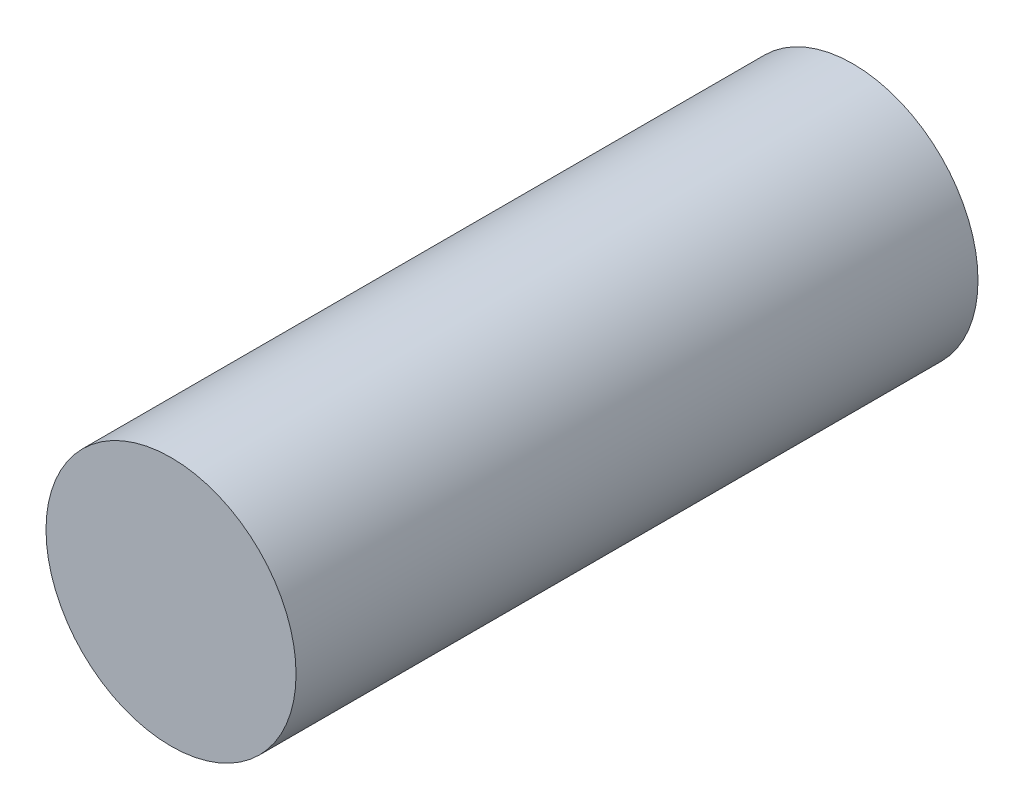
from build123d import *

# Parameters (mm, degrees)
SKETCH2_R           = 5.5
BOSS_EXTRUDE1_DEPTH = 15


with BuildPart() as part:
    # Sketch2 → Boss-Extrude1 (new, symmetric)
    with BuildSketch(Plane.XY):
        Circle(SKETCH2_R)
    extrude(amount=BOSS_EXTRUDE1_DEPTH, both=True)


solid = part.part
